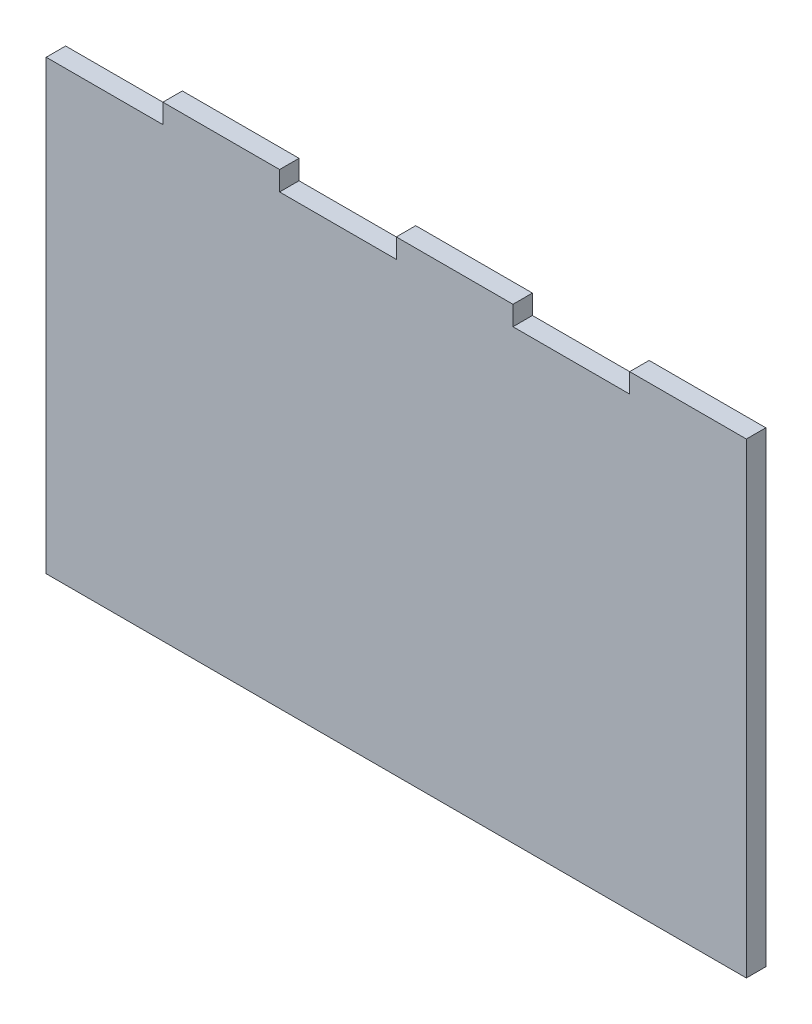
from build123d import *

# Parameters (mm, degrees)
SKETCH1_W           = 457.2
SKETCH1_H           = 304.8
BOSS_EXTRUDE1_DEPTH = 12.7
SKETCH2_W           = 76.2
SKETCH2_H           = 12.7
CUT_EXTRUDE2_DEPTH  = 276.036379412


with BuildPart() as part:
    # Sketch1 → Boss-Extrude1 (new body)
    with BuildSketch(Plane.XY):
        Rectangle(SKETCH1_W, SKETCH1_H)
    extrude(amount=BOSS_EXTRUDE1_DEPTH)

    # Sketch2 → Cut-Extrude2 (cut, through all)
    with BuildSketch(Plane.XY.offset(12.7)):
        with Locations((114.3, 146.05)):
            Rectangle(SKETCH2_W, SKETCH2_H)
        with Locations((-190.5, 146.05)):
            Rectangle(SKETCH2_W, SKETCH2_H)
        with Locations((-38.1, 146.05)):
            Rectangle(SKETCH2_W, SKETCH2_H)
    extrude(amount=-CUT_EXTRUDE2_DEPTH, mode=Mode.SUBTRACT)


solid = part.part
